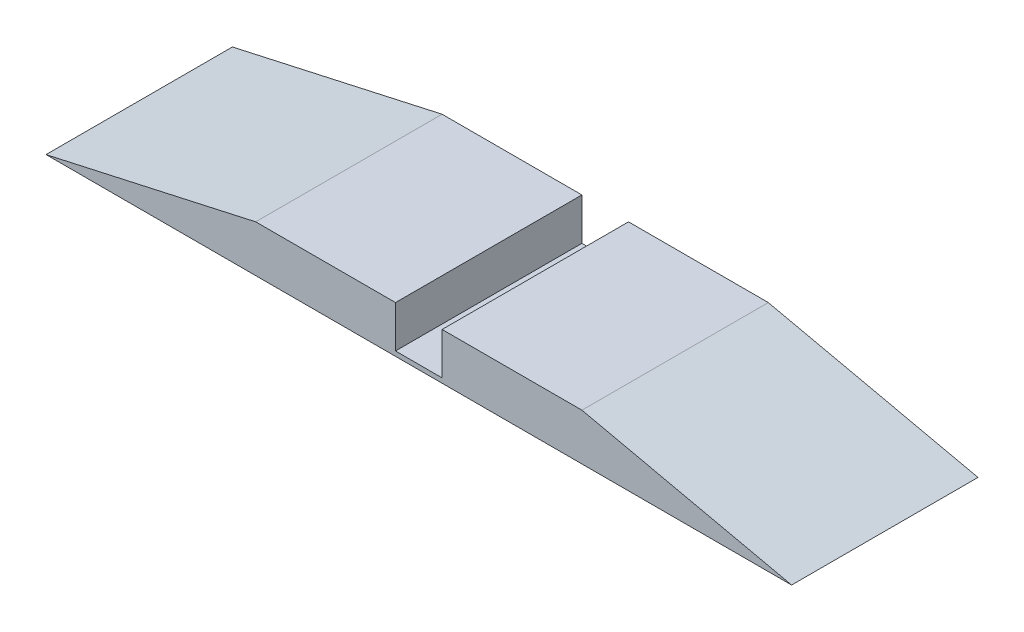
from build123d import *

# Parameters (mm, degrees)
BOSS_EXTRUDE1_DEPTH      = 1000
BOSS_EXTRUDE1_DEPTH_BACK = 1000


with BuildPart() as part:
    # Sketch2 → Boss-Extrude1 (new, two sides: drawn at the far end of the back side and taken through both)
    with BuildSketch(Plane.XY.offset(-BOSS_EXTRUDE1_DEPTH_BACK)):
        Polygon((-4000, -275), (-1750, -275), (-250, -275), (250, -275), (1750, -275), (4000, -275), (1750, 225), (250, 225), (250, -225), (-250, -225), (-250, 225), (-1750, 225), align=None)
    extrude(amount=BOSS_EXTRUDE1_DEPTH + BOSS_EXTRUDE1_DEPTH_BACK)


solid = part.part
